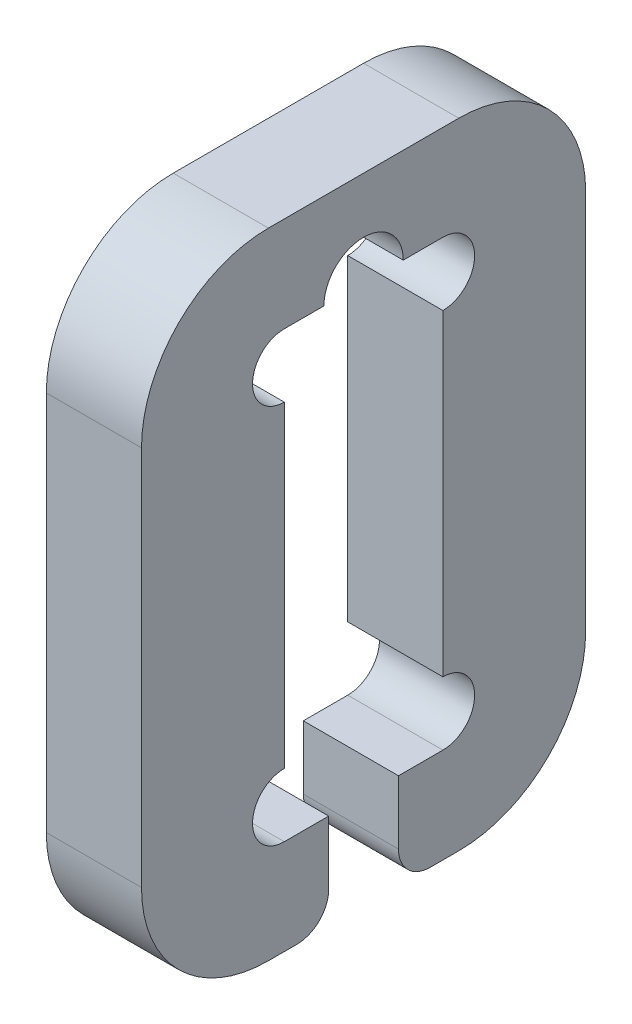
from build123d import *

# Parameters (mm, degrees)
SKETCH_1_W          = 14
SKETCH_1_H          = 20
EXTRUDE_1_DEPTH     = 3
SKETCH_2_W          = 5
SKETCH_2_H          = 14
CUT_EXTRUDE_1_DEPTH = 3
SKETCH_3_R          = 1
CUT_EXTRUDE_2_DEPTH = 3
SKETCH_4_W          = 2.2
SKETCH_4_H          = 3
CUT_EXTRUDE_3_DEPTH = 3
FILLET_1_R          = 4
FILLET_2_R          = 1
SKETCH_5_R          = 1.25
CUT_EXTRUDE_4_DEPTH = 10


with BuildPart() as part:
    # 스케치1 → 보스-돌출1 (new body)
    with BuildSketch(Plane(origin=(0, 0, 0), x_dir=(0, 0, -1), z_dir=(1, 0, 0))):
        with Locations((7, 10)):
            Rectangle(SKETCH_1_W, SKETCH_1_H)
    extrude(amount=EXTRUDE_1_DEPTH)

    # 스케치2 → 컷-돌출1 (cut)
    with BuildSketch(Plane(origin=(3, 0, 0), x_dir=(0, 0, -1), z_dir=(1, 0, 0))):
        with Locations((7, 10)):
            Rectangle(SKETCH_2_W, SKETCH_2_H)
    extrude(amount=-CUT_EXTRUDE_1_DEPTH, mode=Mode.SUBTRACT)

    # 스케치3 → 컷-돌출2 (cut)
    with BuildSketch(Plane(origin=(3, 0, 0), x_dir=(0, 0, -1), z_dir=(1, 0, 0))):
        with Locations((9.5, 16)):
            Circle(SKETCH_3_R)
        with Locations((4.5, 16)):
            Circle(SKETCH_3_R)
        with Locations((4.5, 4)):
            Circle(SKETCH_3_R)
        with Locations((9.5, 4)):
            Circle(SKETCH_3_R)
    extrude(amount=-CUT_EXTRUDE_2_DEPTH, mode=Mode.SUBTRACT)

    # 스케치4 → 컷-돌출3 (cut)
    with BuildSketch(Plane(origin=(3, 0, 0), x_dir=(0, 0, -1), z_dir=(1, 0, 0))):
        with Locations((7, 1.5)):
            Rectangle(SKETCH_4_W, SKETCH_4_H)
    extrude(amount=-CUT_EXTRUDE_3_DEPTH, mode=Mode.SUBTRACT)

    # 필렛1
    fillet_1_edges = [part.edges().sort_by_distance(p)[0] for p in [
        (1.5, 20, 0),
        (1.5, 20, -14),
        (1.5, 0, -14),
        (1.5, 0, 0),
    ]]
    fillet(fillet_1_edges, radius=FILLET_1_R)

    # 필렛2
    fillet_2_edges = [part.edges().sort_by_distance(p)[0] for p in [
        (1.5, 0, -8.1),
        (1.5, 0, -5.9),
    ]]
    fillet(fillet_2_edges, radius=FILLET_2_R)

    # 스케치5 → 컷-돌출4 (cut)
    with BuildSketch(Plane(origin=(3, 0, 0), x_dir=(0, 0, -1), z_dir=(1, 0, 0))):
        with Locations((7, 17)):
            Circle(SKETCH_5_R)
    extrude(amount=-CUT_EXTRUDE_4_DEPTH, mode=Mode.SUBTRACT)


solid = part.part
